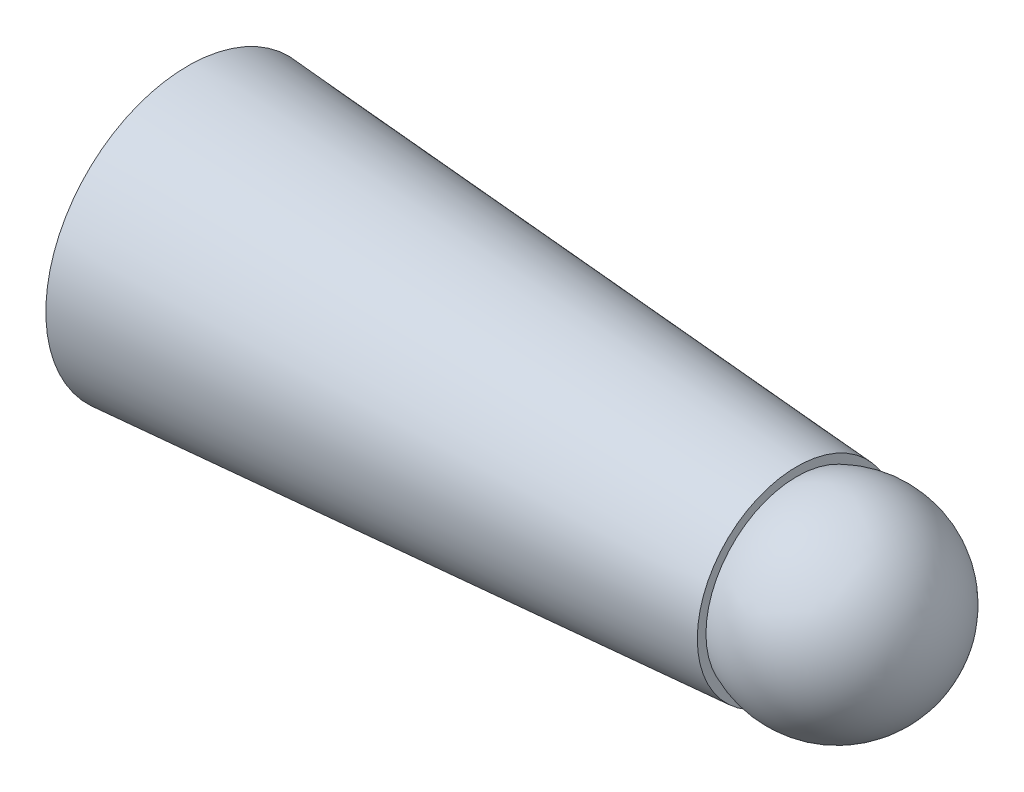
from build123d import *

# Parameters (mm, degrees)
SKETCH1_R           = 3.5
BOSS_EXTRUDE1_DEPTH = 15
BOSS_EXTRUDE1_TAPER = 4


with BuildPart() as part:
    # Sketch1 → Boss-Extrude1 (new body)
    with BuildSketch(Plane(origin=(0, 0, 0), x_dir=(0, 0, -1), z_dir=(1, 0, 0))):
        Circle(SKETCH1_R)
    extrude(amount=BOSS_EXTRUDE1_DEPTH, taper=BOSS_EXTRUDE1_TAPER)

    # Sketch2 → Revolve1 (revolve)
    with BuildSketch(Plane(origin=(16, 0, 0), x_dir=(0, 0, -1), z_dir=(1, 0, 0))):
        with BuildLine():
            Line((0, 2.451097821), (0, -2.451097821))
            ThreePointArc((0, -2.451097821), (2.451097821, 0), (0, 2.451097821))
        make_face()
    revolve(axis=Axis((16, 2.451097821, 0), (0, -1, 0)))


solid = part.part
